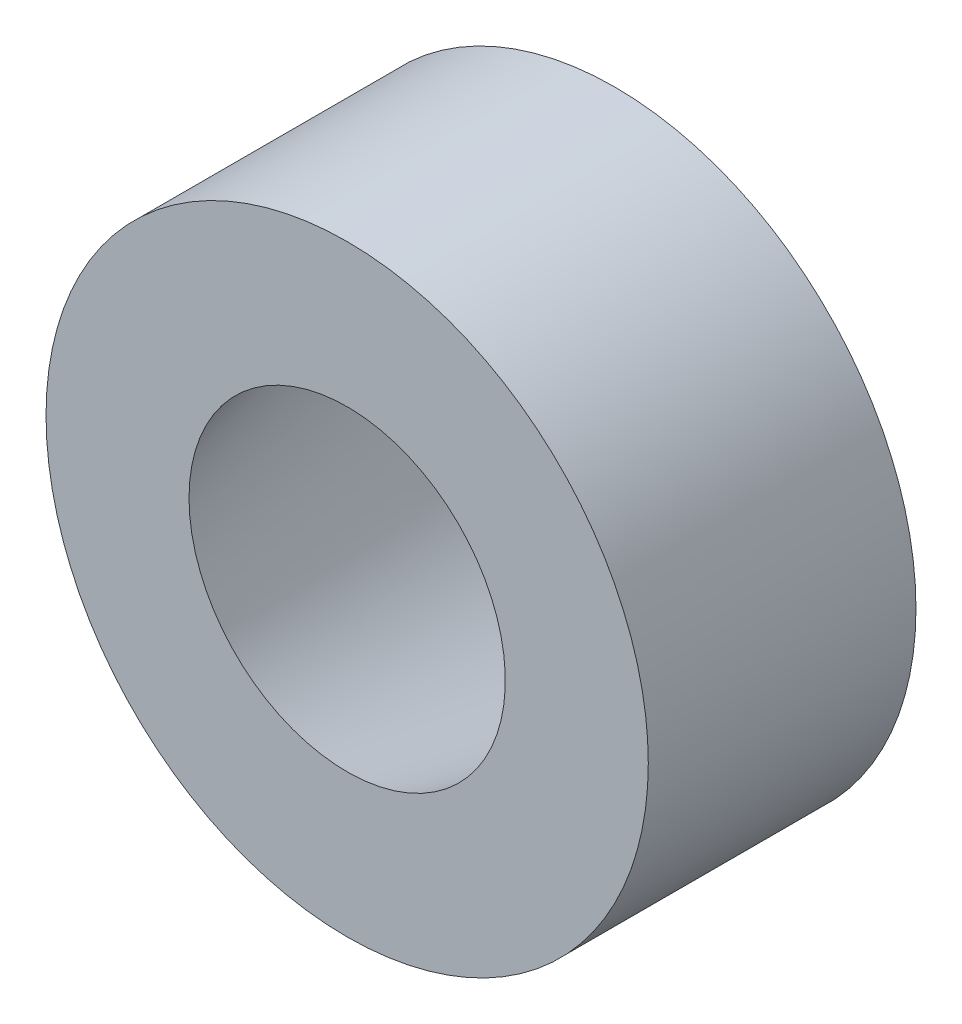
from build123d import *

# Parameters (mm, degrees)
ESQUISSE1_R             = 9
BASE_EXTRUSION_DEPTH    = 8
ESQUISSE2_R             = 6.5
ENL_V_MAT_EXTRU_1_DEPTH = 16.033296378
ENL_V_MAT_EXTRU_1_DRAFT = -12.5


with BuildPart() as part:
    # Esquisse1 → Base-Extrusion (new body)
    with BuildSketch(Plane.XY):
        Circle(ESQUISSE1_R)
    extrude(amount=BASE_EXTRUSION_DEPTH)


with BuildPart() as enl_v_mat_extru_1_tool:
    # Esquisse2 → Enlèv. mat.-Extru.1 (with draft: the straight prism first)
    with BuildSketch(Plane(origin=(0, 0, 0), x_dir=(-1, 0, 0), z_dir=(0, 0, -1))):
        Circle(ESQUISSE2_R)
    extrude(amount=-ENL_V_MAT_EXTRU_1_DEPTH)
    # Enlèv. mat.-Extru.1: the draft: its side faces are tilted about the plane it starts from
    enl_v_mat_extru_1_sides = [enl_v_mat_extru_1_tool.faces().sort_by_distance(p)[0] for p in [
        (6.5, 0, 8.016648189),
    ]]
    draft(enl_v_mat_extru_1_sides, Plane(origin=(0, 0, 0), x_dir=(-1, 0, 0), z_dir=(0, 0, -1)), ENL_V_MAT_EXTRU_1_DRAFT)


with BuildPart() as part_1:
    add(part.part)

    # Enlèv. mat.-Extru.1: cut by enl_v_mat_extru_1_tool
    add(enl_v_mat_extru_1_tool.part, mode=Mode.SUBTRACT)


solid = part_1.part
